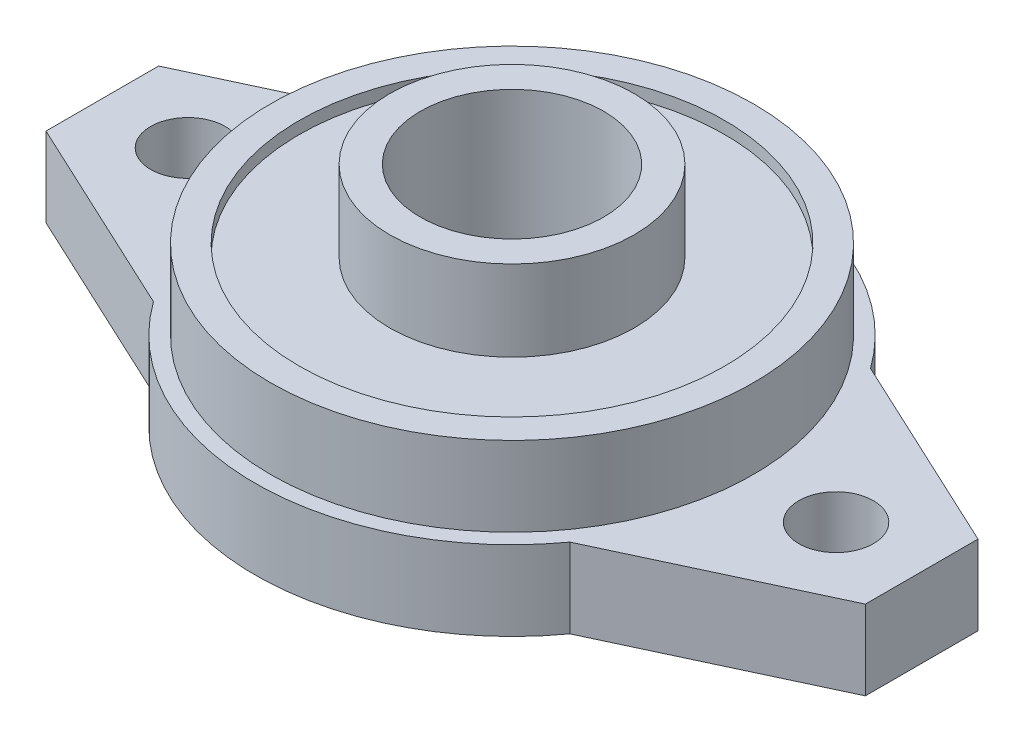
from build123d import *

# Parameters (mm, degrees)
SKETCH_1_R          = 3.05
SKETCH_1_R_2        = 21
SKETCH_1_R_3        = 7.5
EXTRUDE_1_DEPTH     = 6.5
SKETCH_2_R          = 19.75
SKETCH_2_R_2        = 7.5
EXTRUDE_2_DEPTH     = 6.5
SKETCH_3_R          = 10
SKETCH_3_R_2        = 7.5
EXTRUDE_3_DEPTH     = 5.6
CUT_EXTRUDE_START   = -1
SKETCH_4_R          = 17.4
SKETCH_4_R_2        = 10
CUT_EXTRUDE_1_DEPTH = 1


with BuildPart() as part:
    # 草图1 → 凸台-拉伸1 (new body)
    # profile 1 of 3: a face of its own
    with BuildSketch(Plane(origin=(0, 0, 0), x_dir=(1, 0, 0), z_dir=(0, 1, 0))):
        with BuildLine():
            Line((-17.025748483, 12.293245649), (-33.5, 4.60495562))
            Line((-33.5, 4.60495562), (-33.5, -4.60495562))
            Line((-33.5, -4.60495562), (-17.025748483, -12.293245649))
            ThreePointArc((-17.025748483, -12.293245649), (-21, 0), (-17.025748483, 12.293245649))
        make_face()
        with Locations(Location((-26.5, 0, 0), (0, 0, 90))):
            Circle(SKETCH_1_R, mode=Mode.SUBTRACT)
    # profile 2 of 3: a face of its own
    with BuildSketch(Plane(origin=(0, 0, 0), x_dir=(1, 0, 0), z_dir=(0, 1, 0))):
        Circle(SKETCH_1_R_2)
        with Locations(Location((0, 0, 0), (0, 0, 90))):
            Circle(SKETCH_1_R_3, mode=Mode.SUBTRACT)
    # profile 3 of 3: a face of its own
    with BuildSketch(Plane(origin=(0, 0, 0), x_dir=(1, 0, 0), z_dir=(0, 1, 0))):
        with BuildLine():
            Line((33.5, 4.60495562), (17.025748483, 12.293245649))
            ThreePointArc((17.025748483, 12.293245649), (19.981750651, 6.459848367), (21, 0))
            ThreePointArc((21, 0), (19.981750651, -6.459848367), (17.025748483, -12.293245649))
            Line((17.025748483, -12.293245649), (33.5, -4.60495562))
            Line((33.5, -4.60495562), (33.5, 4.60495562))
        make_face()
        with Locations(Location((26.5, 0, 0), (0, 0, 90))):
            Circle(SKETCH_1_R, mode=Mode.SUBTRACT)
    extrude(amount=EXTRUDE_1_DEPTH)

    # 草图2 → 凸台-拉伸2 (add)
    with BuildSketch(Plane(origin=(0, 6.5, 0), x_dir=(1, 0, 0), z_dir=(0, 1, 0))):
        with Locations(Location((0, 0, 0), (0, 0, 90))):
            Circle(SKETCH_2_R)
        with Locations(Location((0, 0, 0), (0, 0, 90))):
            Circle(SKETCH_2_R_2, mode=Mode.SUBTRACT)
    extrude(amount=EXTRUDE_2_DEPTH)

    # 草图3 → 凸台-拉伸3 (add)
    with BuildSketch(Plane(origin=(0, 13, 0), x_dir=(1, 0, 0), z_dir=(0, 1, 0))):
        with Locations(Location((0, 0, 0), (0, 0, 270))):
            Circle(SKETCH_3_R)
        with Locations(Location((0, 0, 0), (0, 0, 90))):
            Circle(SKETCH_3_R_2, mode=Mode.SUBTRACT)
    extrude(amount=EXTRUDE_3_DEPTH)

    # 草图4 → 切除-拉伸1 (cut)
    with BuildSketch(Plane(origin=(0, 13, 0), x_dir=(1, 0, 0), z_dir=(0, 1, 0)).offset(CUT_EXTRUDE_START)):
        with Locations(Location((0, 0, 0), (0, 0, 270))):
            Circle(SKETCH_4_R)
        with Locations(Location((0, 0, 0), (0, 0, 270))):
            Circle(SKETCH_4_R_2, mode=Mode.SUBTRACT)
    extrude(amount=CUT_EXTRUDE_1_DEPTH, mode=Mode.SUBTRACT)


solid = part.part
